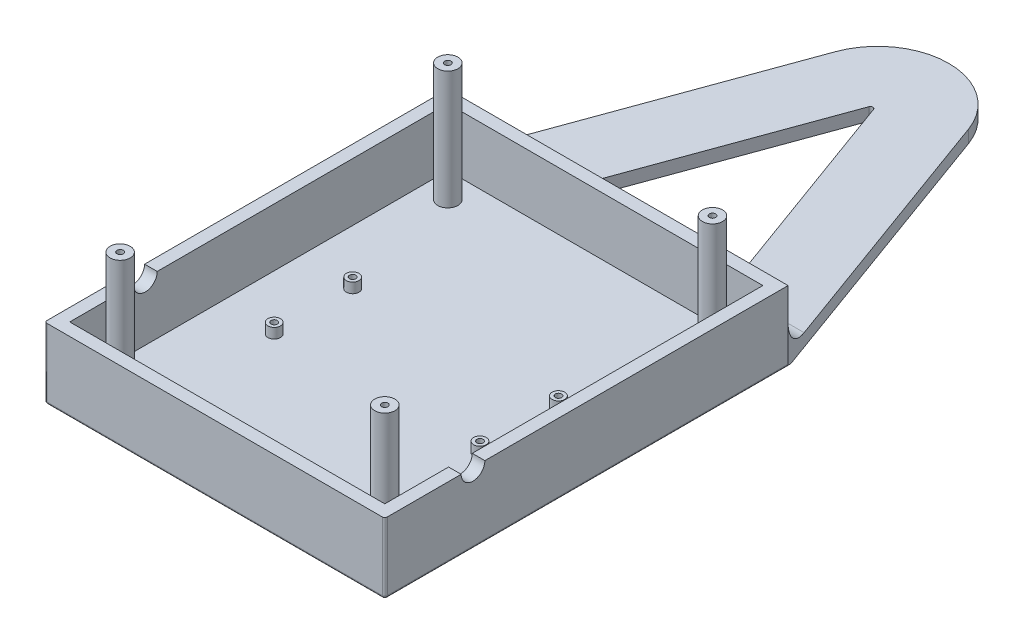
from build123d import *

# Parameters (mm, degrees)
BOSS_EXTRUDE1_DEPTH            = 5
SKETCH2_W                      = 135
SKETCH2_H                      = 160
SKETCH2_W_2                    = 125
SKETCH2_H_2                    = 150
BOSS_EXTRUDE2_DEPTH            = 23
SKETCH3_R                      = 4.7
CUT_EXTRUDE1_DEPTH             = 140
SKETCH4_R                      = 4
BOSS_EXTRUDE3_DEPTH            = 47
F_2_5MM_DOWEL_HOLE1_D          = 2.5
F_2_5MM_DOWEL_HOLE1_DEPTH      = 12
F_2_5MM_DOWEL_HOLE1_TIP        = 0.751075774
FILLET1_R                      = 1
SKETCH8_R                      = 2.5
BOSS_EXTRUDE4_DEPTH            = 4
F_2_5_2_5_DIAMETER_HOLE2_D     = 2.5
F_2_5_2_5_DIAMETER_HOLE2_DEPTH = 5
F_2_5_2_5_DIAMETER_HOLE2_TIP   = 0.751075774
FILLET2_R                      = 10


with BuildPart() as part:
    # Sketch1 → Boss-Extrude1 (new body)
    with BuildSketch(Plane(origin=(0, 0, 0), x_dir=(1, 0, 0), z_dir=(0, 1, 0))):
        with BuildLine():
            Line((-67.5, 80), (-67.5, -80))
            Line((-67.5, -80), (67.5, -80))
            Line((67.5, -80), (67.5, 80))
            Line((67.5, 80), (26.490666647, 192.672217375))
            ThreePointArc((26.490666647, 192.672217375), (0, 211.221181853), (-26.490666647, 192.672217375))
            Line((-26.490666647, 192.672217375), (-67.5, 80))
        make_face()
        Polygon((-37.5, 80), (37.5, 80), (0, 183.03040323), align=None, mode=Mode.SUBTRACT)
    extrude(amount=BOSS_EXTRUDE1_DEPTH)

    # Sketch2 → Boss-Extrude2 (add)
    with BuildSketch(Plane(origin=(0, 5, 0), x_dir=(1, 0, 0), z_dir=(0, 1, 0))):
        Rectangle(SKETCH2_W, SKETCH2_H)
        Rectangle(SKETCH2_W_2, SKETCH2_H_2, mode=Mode.SUBTRACT)
    extrude(amount=BOSS_EXTRUDE2_DEPTH)

    # Sketch3 → Cut-Extrude1 (cut)
    with BuildSketch(Plane(origin=(67.5, 0, 0), x_dir=(0, 0, -1), z_dir=(1, 0, 0))):
        with Locations((-45, 28)):
            Circle(SKETCH3_R)
    extrude(amount=-CUT_EXTRUDE1_DEPTH, mode=Mode.SUBTRACT)

    # Sketch4 → Boss-Extrude3 (add)
    with BuildSketch(Plane(origin=(0, 5, 0), x_dir=(1, 0, 0), z_dir=(0, 1, 0))):
        with Locations(Location((-52.5, 65, 0), (0, 0, 90))):
            Circle(SKETCH4_R)
        with Locations(Location((52.5, 65, 0), (0, 0, 90))):
            Circle(SKETCH4_R)
        with Locations(Location((52.5, -65, 0), (0, 0, 90))):
            Circle(SKETCH4_R)
        with Locations(Location((-52.5, -65, 0), (0, 0, 90))):
            Circle(SKETCH4_R)
    extrude(amount=BOSS_EXTRUDE3_DEPTH)

    # Ø2.5mm Dowel Hole1
    with Locations(Plane(origin=(0, 52, 0), x_dir=(1, 0, 0), z_dir=(0, 1, 0))):
        with Locations((-52.5, 65), (52.5, 65), (52.5, -65), (-52.5, -45), (-52.5, -65)):
            Hole(F_2_5MM_DOWEL_HOLE1_D / 2, depth=F_2_5MM_DOWEL_HOLE1_DEPTH)
            with Locations((0, 0, -(F_2_5MM_DOWEL_HOLE1_DEPTH + F_2_5MM_DOWEL_HOLE1_TIP / 2))):  # 118° drill point
                Cone(0, F_2_5MM_DOWEL_HOLE1_D / 2, F_2_5MM_DOWEL_HOLE1_TIP, mode=Mode.SUBTRACT)

    # Fillet1
    fillet1_edges = [part.edges().sort_by_distance(p)[0] for p in [
        (67.5, 14, 80),
        (-67.5, 14, 80),
        (0, 2.5, -183.03040323),
        (0, 0, 80),
        (-67.5, 0, 0),
        (67.5, 0, 0),
    ]]
    fillet(fillet1_edges, radius=FILLET1_R)

    # Sketch8 → Boss-Extrude4 (add)
    with BuildSketch(Plane(origin=(0, 5, 0), x_dir=(1, 0, 0), z_dir=(0, 1, 0))):
        with Locations(Location((-40.82, 15.565, 0), (0, 0, 90))):
            Circle(SKETCH8_R)
        with Locations(Location((-40.82, -15.565, 0), (0, 0, 90))):
            Circle(SKETCH8_R)
        with Locations(Location((40.82, -15.565, 0), (0, 0, 90))):
            Circle(SKETCH8_R)
        with Locations(Location((40.82, 15.565, 0), (0, 0, 90))):
            Circle(SKETCH8_R)
    extrude(amount=BOSS_EXTRUDE4_DEPTH)

    # Ø2.5 (2.5) Diameter Hole2
    with Locations(Plane(origin=(0, 9, 0), x_dir=(1, 0, 0), z_dir=(0, 1, 0))):
        with Locations((-40.82, 15.565), (-40.82, -15.565), (40.82, -15.565), (40.82, 15.565)):
            Hole(F_2_5_2_5_DIAMETER_HOLE2_D / 2, depth=F_2_5_2_5_DIAMETER_HOLE2_DEPTH)
            with Locations((0, 0, -(F_2_5_2_5_DIAMETER_HOLE2_DEPTH + F_2_5_2_5_DIAMETER_HOLE2_TIP / 2))):  # 118° drill point
                Cone(0, F_2_5_2_5_DIAMETER_HOLE2_D / 2, F_2_5_2_5_DIAMETER_HOLE2_TIP, mode=Mode.SUBTRACT)

    # Fillet2
    fillet2_edges = [part.edges().sort_by_distance(p)[0] for p in [
        (-52.5, 5, -80),
        (52.5, 5, -80),
    ]]
    fillet(fillet2_edges, radius=FILLET2_R)


solid = part.part
